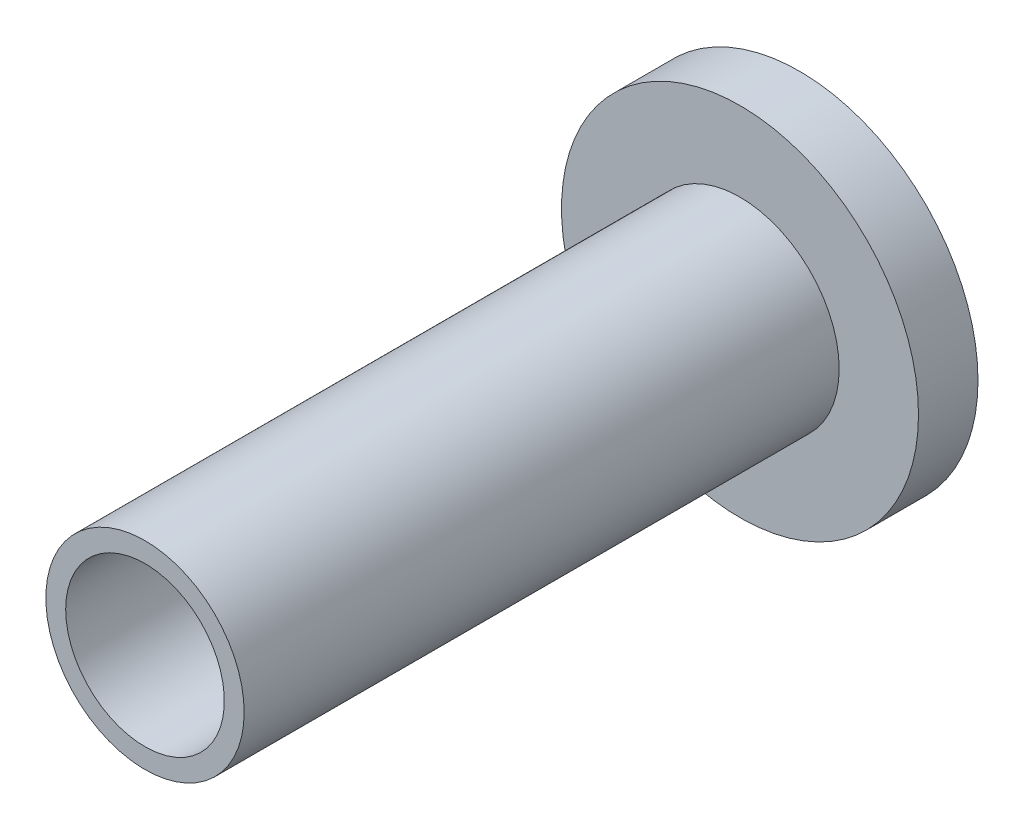
from build123d import *

# Parameters (mm, degrees)
ESQUISSE1_R                  = 2.5
BOSS_EXTRU_1_DEPTH           = 15
ESQUISSE2_R                  = 4.5
BOSS_EXTRU_2_DEPTH           = 1.5
ENL_V_MAT_EXTRU_1_DEPTH      = 18.684739184
ENL_V_MAT_EXTRU_1_DEPTH_BACK = 10
ESQUISSE3_R                  = 2


with BuildPart() as part:
    # Esquisse1 → Boss.-Extru.1 (new body)
    with BuildSketch(Plane.XY):
        Circle(ESQUISSE1_R)
    extrude(amount=BOSS_EXTRU_1_DEPTH)

    # Esquisse2 → Boss.-Extru.2 (add)
    with BuildSketch(Plane.XY):
        Circle(ESQUISSE2_R)
        Polygon((-1.718731116, -0.115769453), (-1.718731116, 0.115769453), (-0.115769453, 0.115769453), (-0.115769453, 1.718731116), (0.115769453, 1.718731116), (0.115769453, 0.115769453), (1.718731116, 0.115769453), (1.718731116, -0.115769453), (0.115769453, -0.115769453), (0.115769453, -1.718731116), (-0.115769453, -1.718731116), (-0.115769453, -0.115769453), align=None, mode=Mode.SUBTRACT)
    extrude(amount=-BOSS_EXTRU_2_DEPTH)

    # Esquisse3 → Enlèv. mat.-Extru.1 (cut, two sides: drawn at the far end of the back side and taken through both)
    with BuildSketch(Plane.XY.offset(15).offset(-ENL_V_MAT_EXTRU_1_DEPTH_BACK)):
        with Locations(Location((0, 0, 0), (0, 0, 180))):
            Circle(ESQUISSE3_R)
    extrude(amount=ENL_V_MAT_EXTRU_1_DEPTH + ENL_V_MAT_EXTRU_1_DEPTH_BACK, mode=Mode.SUBTRACT)


solid = part.part
